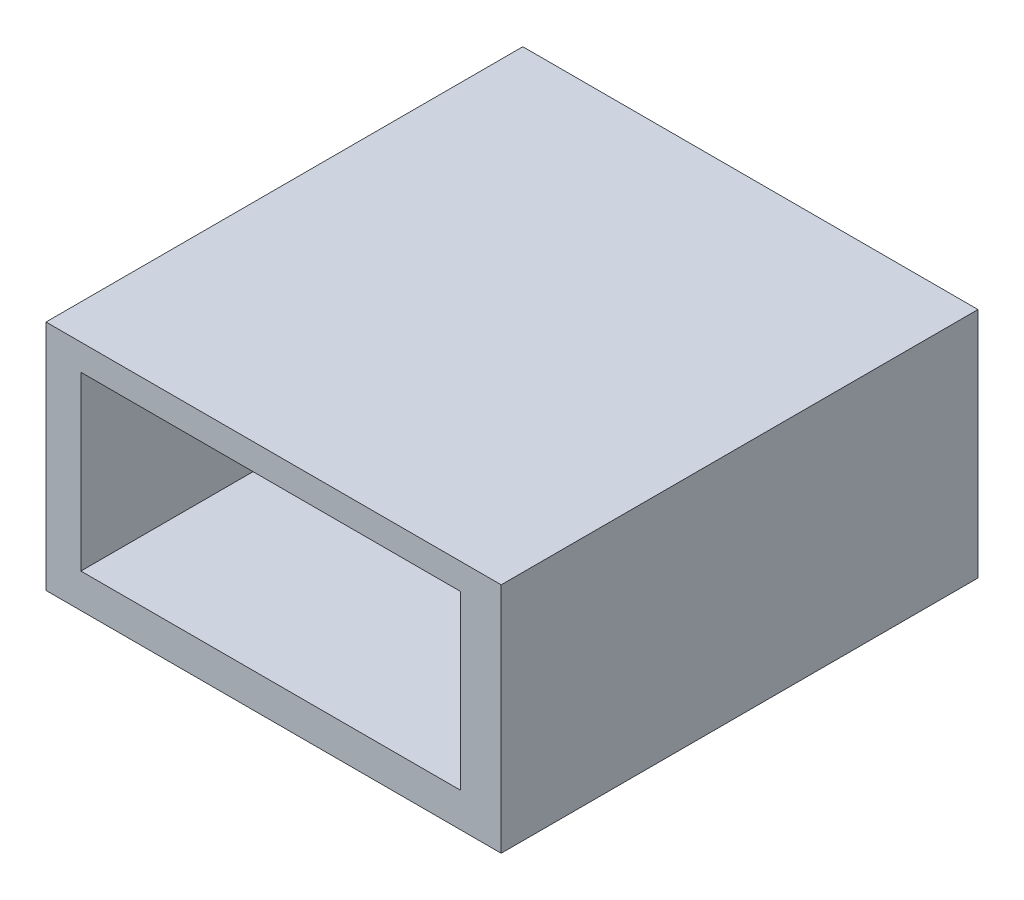
from build123d import *

# Parameters (mm, degrees)
SKETCH1_W           = 143.197884566
SKETCH1_H           = 73.144243195
BOSS_EXTRUDE1_DEPTH = 150
SKETCH2_W           = 119.483916203
SKETCH2_H           = 54.168649407
CUT_EXTRUDE1_DEPTH  = 130


with BuildPart() as part:
    # Sketch1 → Boss-Extrude1 (new body)
    with BuildSketch(Plane.XY):
        with Locations((-1.20190071, -7.554804462)):
            Rectangle(SKETCH1_W, SKETCH1_H)
    extrude(amount=BOSS_EXTRUDE1_DEPTH)

    # Sketch2 → Cut-Extrude1 (cut)
    with BuildSketch(Plane.XY.offset(150)):
        with Locations((-2.08189682, -6.266436867)):
            Rectangle(SKETCH2_W, SKETCH2_H)
    extrude(amount=-CUT_EXTRUDE1_DEPTH, mode=Mode.SUBTRACT)


solid = part.part
